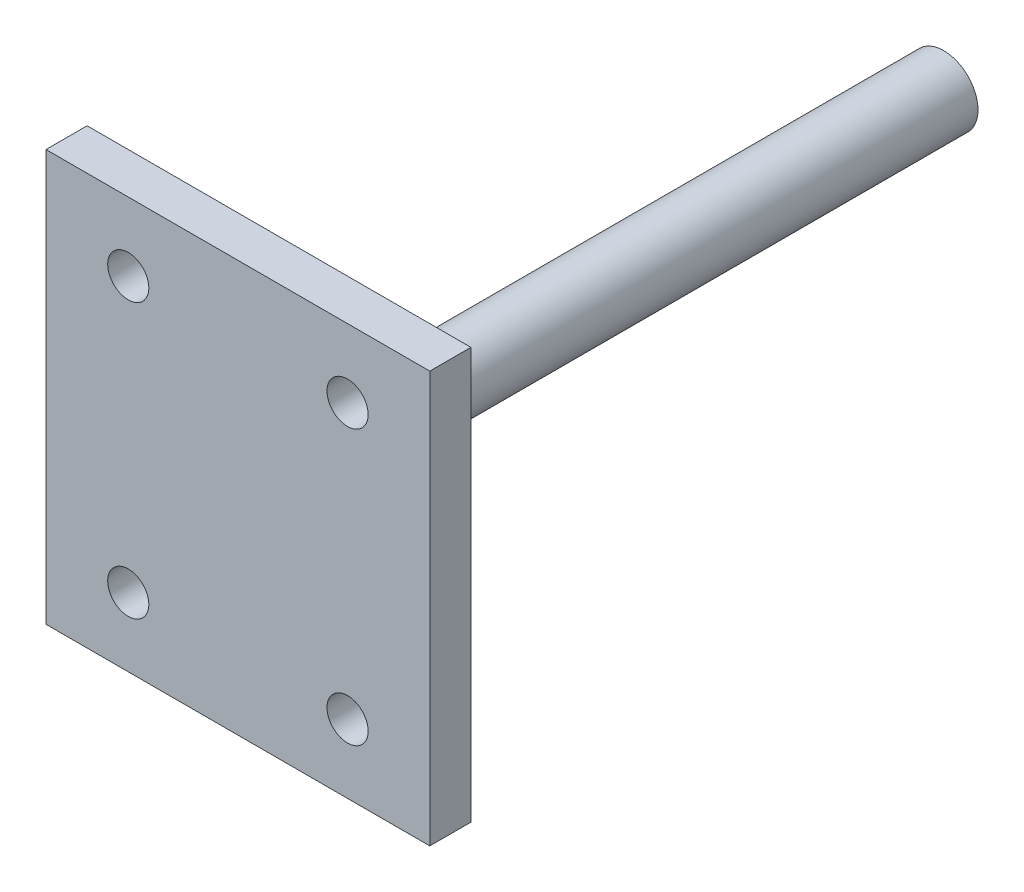
from build123d import *

# Parameters (mm, degrees)
SKETCH_1_W                      = 28
SKETCH_1_H                      = 30
EXTRUDE_1_DEPTH                 = 3
CUT_EXTRUDE_1_REACH             = 43.146
SKETCH_2_R                      = 1.5
CUT_EXTRUDE_1_DIRECTION_2_DEPTH = 42.146081223
SKETCH_3_R                      = 2.495
EXTRUDE_2_DEPTH                 = 48.5


with BuildPart() as part:
    # 草图1 → 凸台-拉伸1 (new body)
    with BuildSketch(Plane.XY):
        with Locations((14, 15)):
            Rectangle(SKETCH_1_W, SKETCH_1_H)
    extrude(amount=EXTRUDE_1_DEPTH)

    # 草图2 → 切除-拉伸1 (cut, up to next)
    with BuildSketch(Plane.XY.offset(3), mode=Mode.PRIVATE) as cut_extrude_1_sk1:
        with Locations(Location((6, 25, 0), (0, 0, 180))):
            Circle(SKETCH_2_R)
    cut_extrude_1_tool1 = extrude(cut_extrude_1_sk1.sketch, amount=-CUT_EXTRUDE_1_REACH, mode=Mode.PRIVATE) & part.part
    # 草图2 → 切除-拉伸1 (cut, up to next)
    with BuildSketch(Plane.XY.offset(3), mode=Mode.PRIVATE) as cut_extrude_1_sk2:
        with Locations(Location((22, 25, 0), (0, 0, 180))):
            Circle(SKETCH_2_R)
    cut_extrude_1_tool2 = extrude(cut_extrude_1_sk2.sketch, amount=-CUT_EXTRUDE_1_REACH, mode=Mode.PRIVATE) & part.part
    # 草图2 → 切除-拉伸1 (cut, up to next)
    with BuildSketch(Plane.XY.offset(3), mode=Mode.PRIVATE) as cut_extrude_1_sk3:
        with Locations(Location((22, 5, 0), (0, 0, 180))):
            Circle(SKETCH_2_R)
    cut_extrude_1_tool3 = extrude(cut_extrude_1_sk3.sketch, amount=-CUT_EXTRUDE_1_REACH, mode=Mode.PRIVATE) & part.part
    # 草图2 → 切除-拉伸1 (cut, up to next)
    with BuildSketch(Plane.XY.offset(3), mode=Mode.PRIVATE) as cut_extrude_1_sk4:
        with Locations(Location((6, 5, 0), (0, 0, 180))):
            Circle(SKETCH_2_R)
    cut_extrude_1_tool4 = extrude(cut_extrude_1_sk4.sketch, amount=-CUT_EXTRUDE_1_REACH, mode=Mode.PRIVATE) & part.part
    add(cut_extrude_1_tool1.solids().sort_by_distance((6, 25, 3))[0], mode=Mode.SUBTRACT)
    add(cut_extrude_1_tool2.solids().sort_by_distance((22, 25, 3))[0], mode=Mode.SUBTRACT)
    add(cut_extrude_1_tool3.solids().sort_by_distance((22, 5, 3))[0], mode=Mode.SUBTRACT)
    add(cut_extrude_1_tool4.solids().sort_by_distance((6, 5, 3))[0], mode=Mode.SUBTRACT)

    # 草图2 → 切除-拉伸1 direction 2 (cut)
    with BuildSketch(Plane.XY.offset(3)):
        with Locations(Location((6, 25, 0), (0, 0, 180))):
            Circle(SKETCH_2_R)
        with Locations(Location((22, 25, 0), (0, 0, 180))):
            Circle(SKETCH_2_R)
        with Locations(Location((22, 5, 0), (0, 0, 180))):
            Circle(SKETCH_2_R)
        with Locations(Location((6, 5, 0), (0, 0, 180))):
            Circle(SKETCH_2_R)
    extrude(amount=CUT_EXTRUDE_1_DIRECTION_2_DEPTH, mode=Mode.SUBTRACT)

    # 草图3 → 凸台-拉伸2 (add)
    with BuildSketch(Plane(origin=(0, 0, 0), x_dir=(-1, 0, 0), z_dir=(0, 0, -1))):
        with Locations(Location((-14, 15, 0), (0, 0, 180))):
            Circle(SKETCH_3_R)
    extrude(amount=EXTRUDE_2_DEPTH)


solid = part.part
